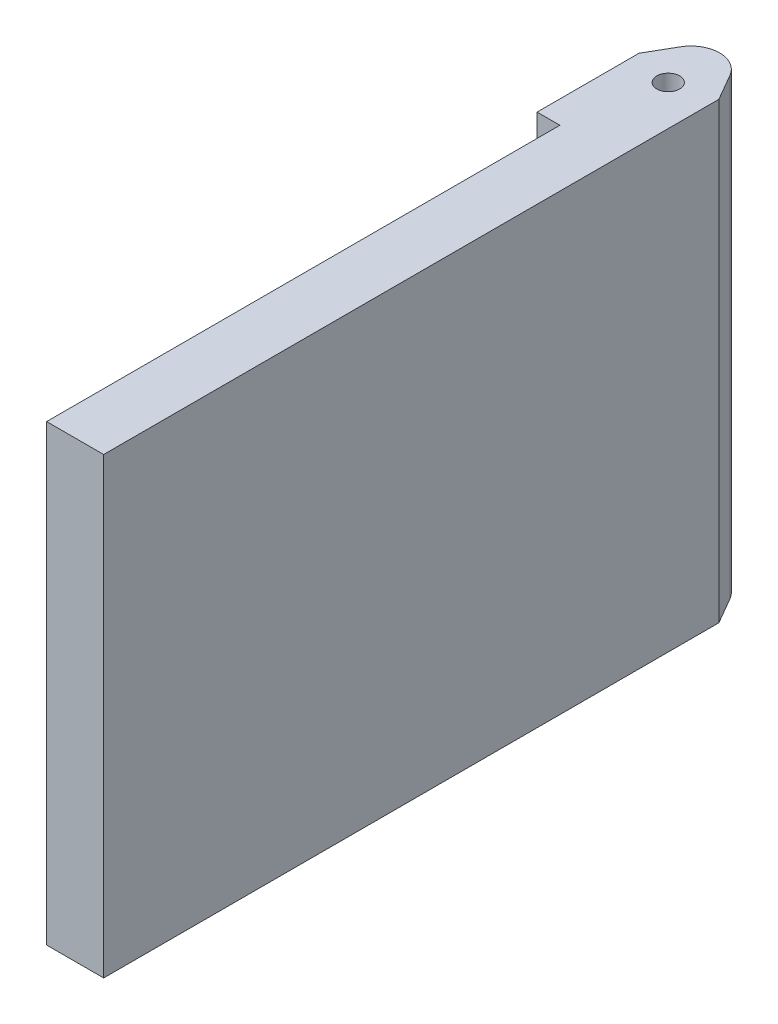
from build123d import *

# Parameters (mm, degrees)
SKETCH1_W           = 30
SKETCH1_H           = 120
BOSS_EXTRUDE1_DEPTH = 79.5
SKETCH2_OUTSIDE_W   = 61.408
SKETCH2_OUTSIDE_H   = 151.408
CUT_EXTRUDE2_DEPTH  = 101.723631785
FILLET1_R           = 5
CUT_EXTRUDE3_DEPTH  = 101.723631785
SKETCH4_W           = 4
SKETCH4_H           = 90
CUT_EXTRUDE4_DEPTH  = 100.846131623
SKETCH5_R           = 2
CUT_EXTRUDE5_DEPTH  = 100.846131623


with BuildPart() as part:
    # Sketch1 → Boss-Extrude1 (new body)
    with BuildSketch(Plane(origin=(0, 0, 0), x_dir=(1, 0, 0), z_dir=(0, 1, 0))):
        Rectangle(SKETCH1_W, SKETCH1_H)
    extrude(amount=BOSS_EXTRUDE1_DEPTH)

    # Sketch2 outside → Cut-Extrude2 (cut, through all)
    with BuildSketch(Plane(origin=(0, 79.5, 0), x_dir=(1, 0, 0), z_dir=(0, 1, 0))):
        Rectangle(SKETCH2_OUTSIDE_W, SKETCH2_OUTSIDE_H)
        Polygon((0, 60), (-15, 34.019237886), (-15, -60), (15, -60), (15, 34.019237886), align=None, mode=Mode.SUBTRACT)
    extrude(amount=-CUT_EXTRUDE2_DEPTH, mode=Mode.SUBTRACT)

    # Fillet1
    fillet1_edges = [part.edges().sort_by_distance(p)[0] for p in [
        (0, 39.75, -60),
    ]]
    fillet(fillet1_edges, radius=FILLET1_R)

    # Sketch3 → Cut-Extrude3 (cut, through all)
    with BuildSketch(Plane(origin=(0, 79.5, 0), x_dir=(1, 0, 0), z_dir=(0, 1, 0))):
        Polygon((-15, 34.019237886), (-15, -60), (-7, -60), (-7, 47.875644347), align=None)
        Polygon((7, 47.875644347), (7, -60), (15, -60), (15, 34.019237886), align=None)
    extrude(amount=-CUT_EXTRUDE3_DEPTH, mode=Mode.SUBTRACT)

    # Sketch4 → Cut-Extrude4 (cut, through all)
    with BuildSketch(Plane(origin=(0, 79.5, 0), x_dir=(1, 0, 0), z_dir=(0, 1, 0))):
        with Locations((-5, -15)):
            Rectangle(SKETCH4_W, SKETCH4_H)
    extrude(amount=-CUT_EXTRUDE4_DEPTH, mode=Mode.SUBTRACT)

    # Sketch5 → Cut-Extrude5 (cut, through all)
    with BuildSketch(Plane(origin=(0, 79.5, 0), x_dir=(1, 0, 0), z_dir=(0, 1, 0))):
        with Locations(Location((0, 46, 0), (0, 0, 270))):
            Circle(SKETCH5_R)
    extrude(amount=-CUT_EXTRUDE5_DEPTH, mode=Mode.SUBTRACT)


solid = part.part
